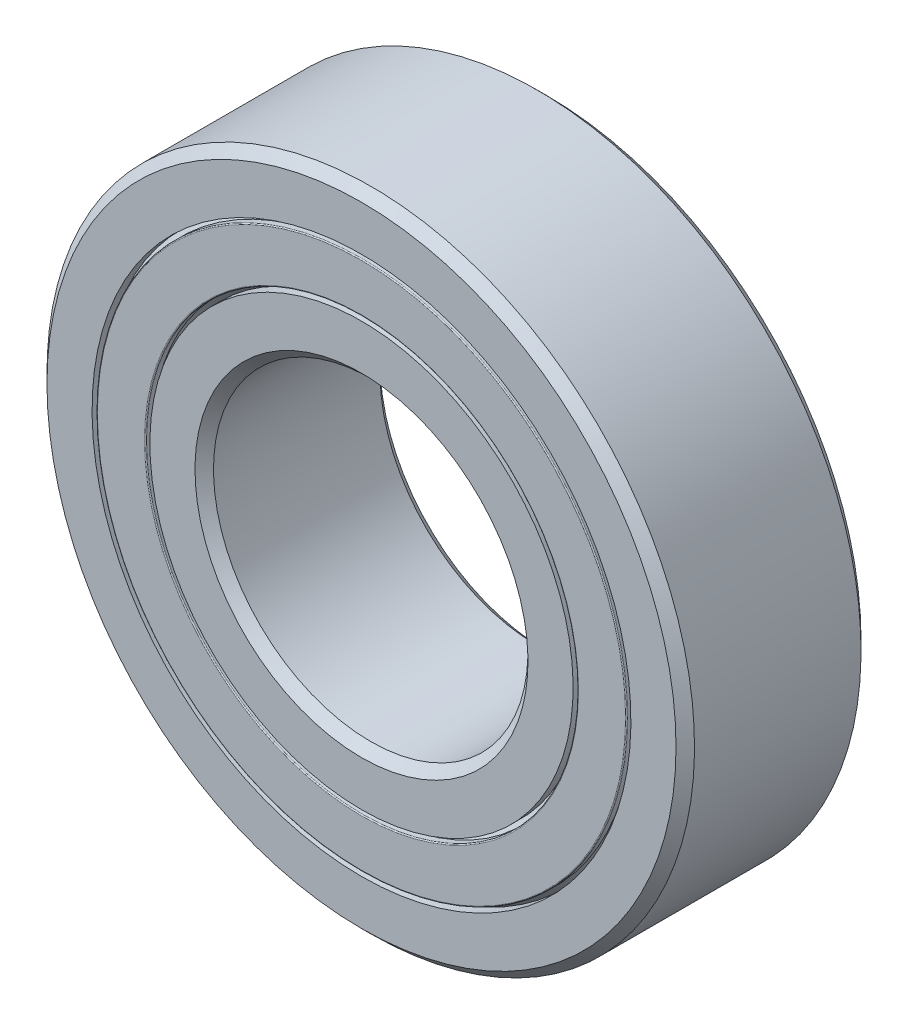
from build123d import *

# Parameters (mm, degrees)
CIRPATTERN1_COUNT   = 10
SKETCH7_R           = 13.78125
SKETCH7_R_2         = 13
BOSS_EXTRUDE1_DEPTH = 0.833333333
FILLET1_R           = 0.055555556
FILLET2_R           = 0.055555556


with BuildPart() as part:
    # Sketch3 → Revolve1 (revolve)
    with BuildSketch(Plane(origin=(0, 0, 0), x_dir=(0, 0, -1), z_dir=(1, 0, 0)), mode=Mode.PRIVATE) as revolve1_sk:
        with BuildLine():
            Line((4.5, 17.5), (5, 17))
            Line((5, 17), (5, 14.5625))
            Line((5, 14.5625), (2.222222222, 14.5625))
            ThreePointArc((2.222222222, 14.5625), (0, 15.716556249), (-2.222222222, 14.5625))
            Line((-2.222222222, 14.5625), (-5, 14.5625))
            Line((-5, 14.5625), (-5, 17))
            Line((-5, 17), (-4.5, 17.5))
            Line((-4.5, 17.5), (4.5, 17.5))
        make_face()
    revolve(revolve1_sk.sketch.rotate(Axis((0, 0, 5), (0, 0, -1)), 180), axis=Axis((0, 0, 5), (0, 0, -1)))


with BuildPart() as body_2:
    # Sketch4 → Revolve2 (revolve)
    with BuildSketch(Plane(origin=(0, 0, 0), x_dir=(0, 0, -1), z_dir=(1, 0, 0)), mode=Mode.PRIVATE) as revolve2_sk:
        with BuildLine():
            Line((-4.5, 8.5), (-5, 9))
            Line((-5, 9), (-5, 11.4375))
            Line((-5, 11.4375), (-2.222222222, 11.4375))
            ThreePointArc((-2.222222222, 11.4375), (0, 10.283443751), (2.222222222, 11.4375))
            Line((2.222222222, 11.4375), (5, 11.4375))
            Line((5, 11.4375), (5, 9))
            Line((5, 9), (4.5, 8.5))
            Line((4.5, 8.5), (-4.5, 8.5))
        make_face()
    revolve(revolve2_sk.sketch.rotate(Axis((0, 0, 5), (0, 0, -1)), 180), axis=Axis((0, 0, 5), (0, 0, -1)))


with BuildPart() as body_3:
    # Sketch5 → Revolve3 (revolve)
    with BuildSketch(Plane(origin=(0, 0, 0), x_dir=(0, 0, -1), z_dir=(1, 0, 0))):
        with BuildLine():
            Line((-2.716556249, 13), (2.716556249, 13))
            ThreePointArc((2.716556249, 13), (0, 15.716556249), (-2.716556249, 13))
        make_face()
    revolve(axis=Axis((0, 13, 2.716556249), (0, 0, -1)))


with BuildPart() as body_4:
    # Sketch6 → Revolve4 (revolve)
    with BuildSketch(Plane(origin=(0, 0, 0), x_dir=(0, 0, -1), z_dir=(1, 0, 0))):
        with BuildLine():
            Line((-2.6017929, 13.78125), (-3.001494083, 13.78125))
            ThreePointArc((-3.001494083, 13.78125), (-3.201344675, 13), (-3.001494083, 12.21875))
            Line((-3.001494083, 12.21875), (-2.6017929, 12.21875))
            ThreePointArc((-2.6017929, 12.21875), (-2.716556249, 13), (-2.6017929, 13.78125))
        make_face()
    revolve(axis=Axis((0, 17.5, 0), (0, -1, 0)))


with BuildPart() as cirpattern1_1:
    # CirPattern1: pattern copy
    add(body_4.part.rotate(Axis((0, 0, 0), (0, 0, 1)), 1 * 360 / CIRPATTERN1_COUNT))


with BuildPart() as cirpattern1_2:
    # CirPattern1: pattern copy
    add(body_4.part.rotate(Axis((0, 0, 0), (0, 0, 1)), 2 * 360 / CIRPATTERN1_COUNT))


with BuildPart() as cirpattern1_3:
    # CirPattern1: pattern copy
    add(body_4.part.rotate(Axis((0, 0, 0), (0, 0, 1)), 3 * 360 / CIRPATTERN1_COUNT))


with BuildPart() as cirpattern1_4:
    # CirPattern1: pattern copy
    add(body_4.part.rotate(Axis((0, 0, 0), (0, 0, 1)), 4 * 360 / CIRPATTERN1_COUNT))


with BuildPart() as cirpattern1_5:
    # CirPattern1: pattern copy
    add(body_4.part.rotate(Axis((0, 0, 0), (0, 0, 1)), 5 * 360 / CIRPATTERN1_COUNT))


with BuildPart() as cirpattern1_6:
    # CirPattern1: pattern copy
    add(body_4.part.rotate(Axis((0, 0, 0), (0, 0, 1)), 6 * 360 / CIRPATTERN1_COUNT))


with BuildPart() as cirpattern1_7:
    # CirPattern1: pattern copy
    add(body_4.part.rotate(Axis((0, 0, 0), (0, 0, 1)), 7 * 360 / CIRPATTERN1_COUNT))


with BuildPart() as cirpattern1_8:
    # CirPattern1: pattern copy
    add(body_4.part.rotate(Axis((0, 0, 0), (0, 0, 1)), 8 * 360 / CIRPATTERN1_COUNT))


with BuildPart() as cirpattern1_9:
    # CirPattern1: pattern copy
    add(body_4.part.rotate(Axis((0, 0, 0), (0, 0, 1)), 9 * 360 / CIRPATTERN1_COUNT))


with BuildPart() as cirpattern1_10:
    # CirPattern1: pattern copy
    add(body_3.part.rotate(Axis((0, 0, 0), (0, 0, 1)), 1 * 360 / CIRPATTERN1_COUNT))


with BuildPart() as cirpattern1_11:
    # CirPattern1: pattern copy
    add(body_3.part.rotate(Axis((0, 0, 0), (0, 0, 1)), 2 * 360 / CIRPATTERN1_COUNT))


with BuildPart() as cirpattern1_12:
    # CirPattern1: pattern copy
    add(body_3.part.rotate(Axis((0, 0, 0), (0, 0, 1)), 3 * 360 / CIRPATTERN1_COUNT))


with BuildPart() as cirpattern1_13:
    # CirPattern1: pattern copy
    add(body_3.part.rotate(Axis((0, 0, 0), (0, 0, 1)), 4 * 360 / CIRPATTERN1_COUNT))


with BuildPart() as cirpattern1_14:
    # CirPattern1: pattern copy
    add(body_3.part.rotate(Axis((0, 0, 0), (0, 0, 1)), 5 * 360 / CIRPATTERN1_COUNT))


with BuildPart() as cirpattern1_15:
    # CirPattern1: pattern copy
    add(body_3.part.rotate(Axis((0, 0, 0), (0, 0, 1)), 6 * 360 / CIRPATTERN1_COUNT))


with BuildPart() as cirpattern1_16:
    # CirPattern1: pattern copy
    add(body_3.part.rotate(Axis((0, 0, 0), (0, 0, 1)), 7 * 360 / CIRPATTERN1_COUNT))


with BuildPart() as cirpattern1_17:
    # CirPattern1: pattern copy
    add(body_3.part.rotate(Axis((0, 0, 0), (0, 0, 1)), 8 * 360 / CIRPATTERN1_COUNT))


with BuildPart() as cirpattern1_18:
    # CirPattern1: pattern copy
    add(body_3.part.rotate(Axis((0, 0, 0), (0, 0, 1)), 9 * 360 / CIRPATTERN1_COUNT))


with BuildPart() as body_23:
    # Sketch7 → Boss-Extrude1 (new, symmetric)
    with BuildSketch(Plane.XY):
        Circle(SKETCH7_R)
        Circle(SKETCH7_R_2, mode=Mode.SUBTRACT)
    extrude(amount=BOSS_EXTRUDE1_DEPTH, both=True)


with BuildPart() as body_24:
    # Sketch8 → Revolve5 (revolve)
    with BuildSketch(Plane(origin=(0, 0, 0), x_dir=(0, 0, -1), z_dir=(1, 0, 0)), mode=Mode.PRIVATE) as revolve5_sk:
        Polygon((-5, 14.328125), (-4.62962963, 14.328125), (-4.444444444, 14.5625), (-4.444444444, 14.328125), (-4.444444444, 11.671875), (-4.444444444, 11.4375), (-4.62962963, 11.671875), (-5, 11.671875), align=None)
        Polygon((5, 14.328125), (5, 11.671875), (4.62962963, 11.671875), (4.444444444, 11.4375), (4.444444444, 11.671875), (4.444444444, 14.328125), (4.444444444, 14.5625), (4.62962963, 14.328125), align=None)
    revolve(revolve5_sk.sketch.rotate(Axis((0, 0, 5), (0, 0, -1)), 180), axis=Axis((0, 0, 5), (0, 0, -1)))

    # Fillet1
    fillet1_edges = [body_24.edges().sort_by_distance(p)[0] for p in [
        (0, 14.328125, 5),
        (0, 11.671875, 5),
    ]]
    fillet(fillet1_edges, radius=FILLET1_R)

    # Fillet2
    fillet2_edges = [body_24.edges().sort_by_distance(p)[0] for p in [
        (0, 14.328125, -5),
        (0, 11.671875, -5),
    ]]
    fillet(fillet2_edges, radius=FILLET2_R)


solid = Compound([part.part, body_2.part, body_3.part, body_4.part, cirpattern1_1.part, cirpattern1_2.part, cirpattern1_3.part, cirpattern1_4.part, cirpattern1_5.part, cirpattern1_6.part, cirpattern1_7.part, cirpattern1_8.part, cirpattern1_9.part, cirpattern1_10.part, cirpattern1_11.part, cirpattern1_12.part, cirpattern1_13.part, cirpattern1_14.part, cirpattern1_15.part, cirpattern1_16.part, cirpattern1_17.part, cirpattern1_18.part, body_23.part, body_24.part])
